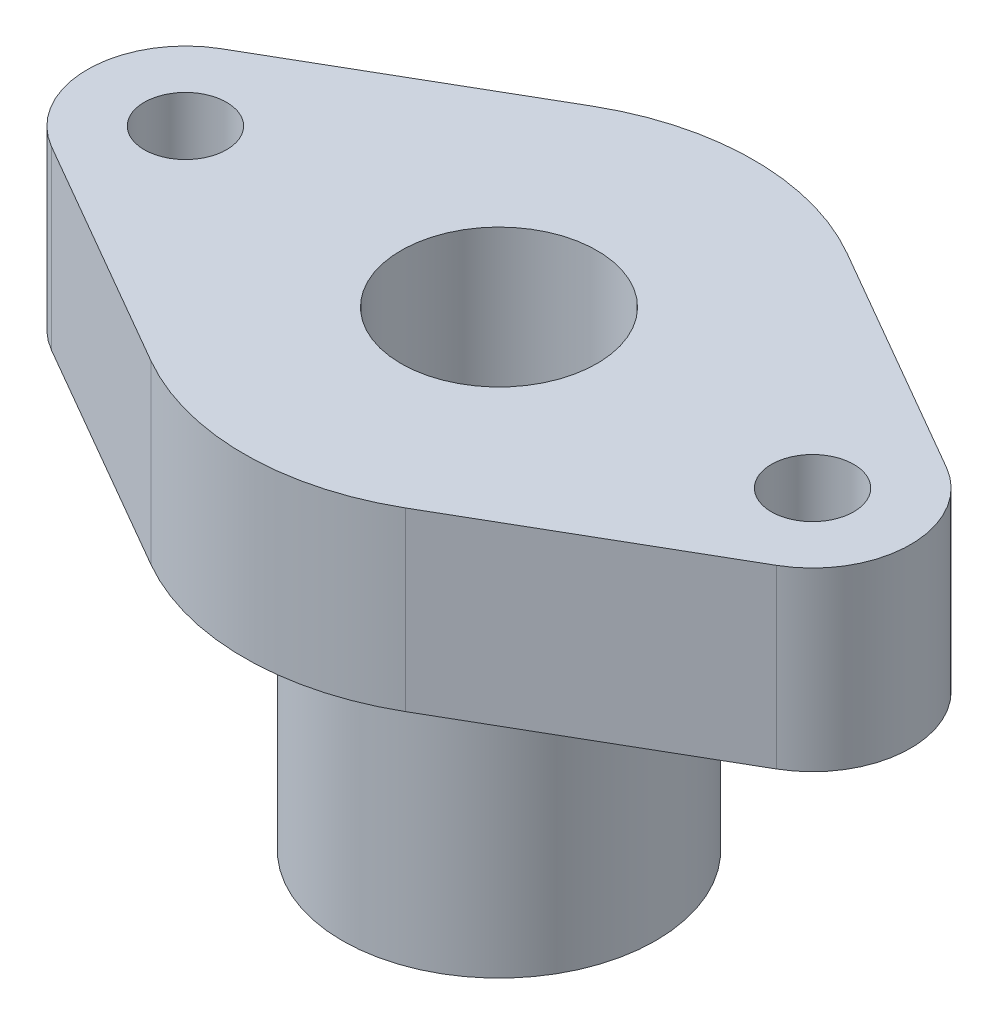
from build123d import *

# Parameters (mm, degrees)
SKETCH1_W                 = 3
SKETCH1_H                 = 15
BOSS_EXTRUDE1_START       = 9
SKETCH2_R                 = 5
BOSS_EXTRUDE1_DEPTH       = 9
M5X0_8_TAPPED_HOLE1_D     = 4.2
M5X0_8_TAPPED_HOLE1_DEPTH = 12.4
M5X0_8_TAPPED_HOLE1_TIP   = 1.2618073


with BuildPart() as part:
    # Sketch1 → Revolve1 (revolve)
    with BuildSketch(Plane.XY, mode=Mode.PRIVATE) as revolve1_sk:
        with Locations((-6.5, -4.132653061)):
            Rectangle(SKETCH1_W, SKETCH1_H)
    revolve(revolve1_sk.sketch.rotate(Axis((0, 8.367346939, 0), (0, -1, 0)), 270), axis=Axis((0, 8.367346939, 0), (0, -1, 0)))

    # Sketch2 → Boss-Extrude1 (add)
    with BuildSketch(Plane(origin=(0, 3.367346939, 0), x_dir=(1, 0, 0), z_dir=(0, 1, 0)).offset(BOSS_EXTRUDE1_START)):
        with BuildLine():
            Line((-6.5, 11.258330249), (-18.5, 4.330127019))
            ThreePointArc((-18.5, 4.330127019), (-21, 0), (-18.5, -4.330127019))
            Line((-18.5, -4.330127019), (-6.5, -11.258330249))
            ThreePointArc((-6.5, -11.258330249), (0, -13), (6.5, -11.258330249))
            Line((6.5, -11.258330249), (18.5, -4.330127019))
            ThreePointArc((18.5, -4.330127019), (21, 0), (18.5, 4.330127019))
            Line((18.5, 4.330127019), (6.5, 11.258330249))
            ThreePointArc((6.5, 11.258330249), (0, 13), (-6.5, 11.258330249))
        make_face()
        with Locations(Location((0, 0, 0), (0, 0, 270))):
            Circle(SKETCH2_R, mode=Mode.SUBTRACT)
    extrude(amount=-BOSS_EXTRUDE1_DEPTH)

    # M5x0.8 Tapped Hole1
    with Locations(Plane(origin=(-16, 12.367346939, 0), x_dir=(0, 0, 1), z_dir=(0, 1, 0))):
        with Locations((0, 0), (0, 32)):
            Hole(M5X0_8_TAPPED_HOLE1_D / 2, depth=M5X0_8_TAPPED_HOLE1_DEPTH)
            with Locations((0, 0, -(M5X0_8_TAPPED_HOLE1_DEPTH + M5X0_8_TAPPED_HOLE1_TIP / 2))):  # 118° drill point
                Cone(0, M5X0_8_TAPPED_HOLE1_D / 2, M5X0_8_TAPPED_HOLE1_TIP, mode=Mode.SUBTRACT)


solid = part.part
